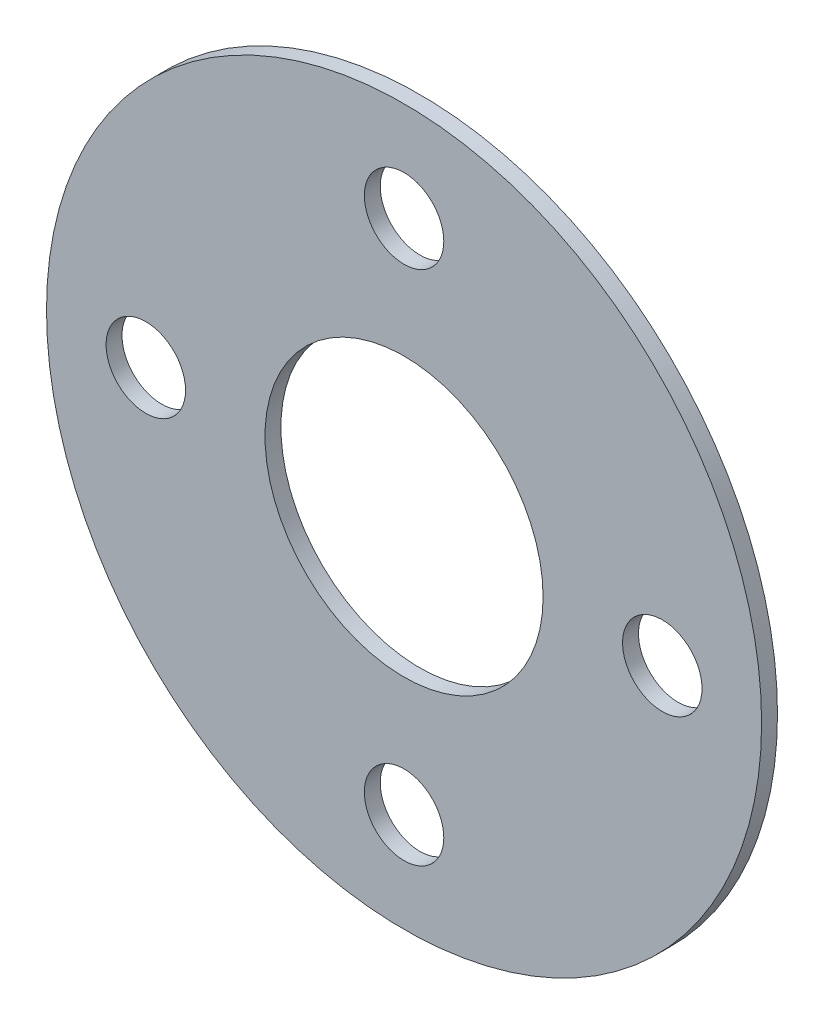
from build123d import *

# Parameters (mm, degrees)
SKETCH1_R           = 45
SKETCH1_R_2         = 5
BOSS_EXTRUDE1_DEPTH = 2
SKETCH2_R           = 17.5
CUT_EXTRUDE1_DEPTH  = 2


with BuildPart() as part:
    # Sketch1 → Boss-Extrude1 (new body)
    with BuildSketch(Plane.XY):
        Circle(SKETCH1_R)
        with Locations((0, 32.5)):
            Circle(SKETCH1_R_2, mode=Mode.SUBTRACT)
        with Locations((32.5, 0)):
            Circle(SKETCH1_R_2, mode=Mode.SUBTRACT)
        with Locations((0, -32.5)):
            Circle(SKETCH1_R_2, mode=Mode.SUBTRACT)
        with Locations((-32.5, 0)):
            Circle(SKETCH1_R_2, mode=Mode.SUBTRACT)
    extrude(amount=BOSS_EXTRUDE1_DEPTH)

    # Sketch2 → Cut-Extrude1 (cut)
    with BuildSketch(Plane.XY.offset(2)):
        Circle(SKETCH2_R)
    extrude(amount=-CUT_EXTRUDE1_DEPTH, mode=Mode.SUBTRACT)


solid = part.part
